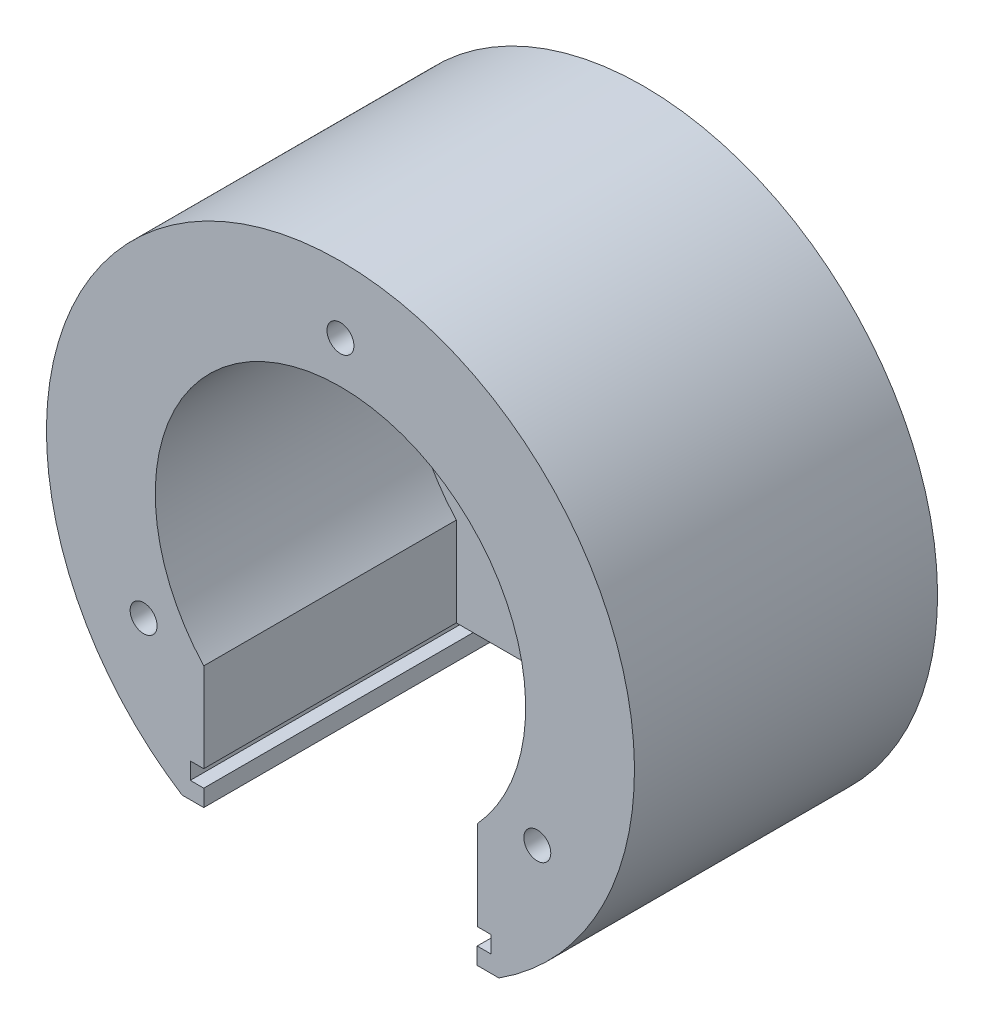
from build123d import *

# Parameters (mm, degrees)
SKETCH2_R           = 17.4625
BOSS_EXTRUDE1_DEPTH = 18
SKETCH13_R          = 0.8
CUT_EXTRUDE6_DEPTH  = 7.3
SKETCH16_R          = 11
CUT_EXTRUDE9_DEPTH  = 15
CUT_EXTRUDE11_DEPTH = 22
SKETCH21_W          = 16.25
SKETCH21_H          = 2.78436417
CUT_EXTRUDE12_DEPTH = 31.559414466
CUT_EXTRUDE13_REACH = 32.559
SKETCH24_W          = 16.25
SKETCH24_H          = 6.70136321
CUT_EXTRUDE14_DEPTH = 17
SKETCH27_W          = 18.82071266
SKETCH27_H          = 0.75
CUT_EXTRUDE15_DEPTH = 31.559414466


with BuildPart() as part:
    # Sketch2 → Boss-Extrude1 (new body)
    with BuildSketch(Plane.XY):
        Circle(SKETCH2_R)
    extrude(amount=BOSS_EXTRUDE1_DEPTH)

    # Sketch13 → Cut-Extrude6 (cut)
    with BuildSketch(Plane.XY.offset(18)):
        with Locations((0, 13.5)):
            Circle(SKETCH13_R)
        with Locations((11.691342951, -6.75)):
            Circle(SKETCH13_R)
        with Locations((-11.691342951, -6.75)):
            Circle(SKETCH13_R)
    extrude(amount=-CUT_EXTRUDE6_DEPTH, mode=Mode.SUBTRACT)

    # Sketch16 → Cut-Extrude9 (cut)
    with BuildSketch(Plane.XY.offset(18)):
        Circle(SKETCH16_R)
    extrude(amount=-CUT_EXTRUDE9_DEPTH, mode=Mode.SUBTRACT)

    # Sketch20 → Cut-Extrude11 (cut)
    with BuildSketch(Plane(origin=(5.95728493, 0, -11.08430825), x_dir=(0, 0, 1), z_dir=(0, 1, 0))):
        Polygon((16.52930825, -11.021800725), (16.52930825, -6.906800725), (14.92930825, -6.906800725), (14.92930825, -4.926800725), (16.52930825, -4.926800725), (16.52930825, -0.811800725), (18.05430825, -0.811800725), (18.05430825, 1.028199275), (22.11430825, 1.028199275), (22.11430825, -0.811800725), (23.63930825, -0.811800725), (23.63930825, -11.021800725), (22.11430825, -11.021800725), (22.11430825, -12.861800725), (18.05430825, -12.861800725), (18.05430825, -11.021800725), align=None)
    extrude(amount=-CUT_EXTRUDE11_DEPTH, mode=Mode.SUBTRACT)

    # Sketch21 → Cut-Extrude12 (cut, through all)
    with BuildSketch(Plane.XY.offset(18)):
        with Locations((0, -16.852182085)):
            Rectangle(SKETCH21_W, SKETCH21_H)
    extrude(amount=-CUT_EXTRUDE12_DEPTH, mode=Mode.SUBTRACT)

    # Cut-Extrude13: up to this face of the body (flat: up to its plane)
    cut_extrude13_end = Plane(part.part.faces().sort_by_distance((0, 0, 3))[0])
    # Sketch24 → Cut-Extrude13 (cut, up to the picked face)
    with BuildSketch(Plane.XY.offset(18), mode=Mode.PRIVATE) as cut_extrude13_sk1:
        with Locations((0.005436819, -10.109318395)):
            Rectangle(SKETCH24_W, SKETCH24_H)
    cut_extrude13_tool1 = split(extrude(cut_extrude13_sk1.sketch, amount=-CUT_EXTRUDE13_REACH, mode=Mode.PRIVATE), bisect_by=cut_extrude13_end, keep=Keep.BOTH, mode=Mode.PRIVATE)
    add(cut_extrude13_tool1.solids().sort_by(Axis((0.005437, -10.109318, 18), (0, 0, -1)))[0], mode=Mode.SUBTRACT)

    # Sketch26 → Cut-Extrude14 (cut)
    with BuildSketch(Plane.XY.offset(18)):
        Polygon((-8.119563181, -13.71), (-8.119563181, -15.46), (8.119563181, -15.46), (8.119563181, -13.71), (8.930436819, -13.71), (8.930436819, -12.71), (-8.919563181, -12.71), (-8.919563181, -13.71), align=None)
    extrude(amount=-CUT_EXTRUDE14_DEPTH, mode=Mode.SUBTRACT)

    # Sketch27 → Cut-Extrude15 (cut, through all)
    with BuildSketch(Plane.XY.offset(18)):
        with Locations((0, -15.085)):
            Rectangle(SKETCH27_W, SKETCH27_H)
    extrude(amount=-CUT_EXTRUDE15_DEPTH, mode=Mode.SUBTRACT)


solid = part.part
